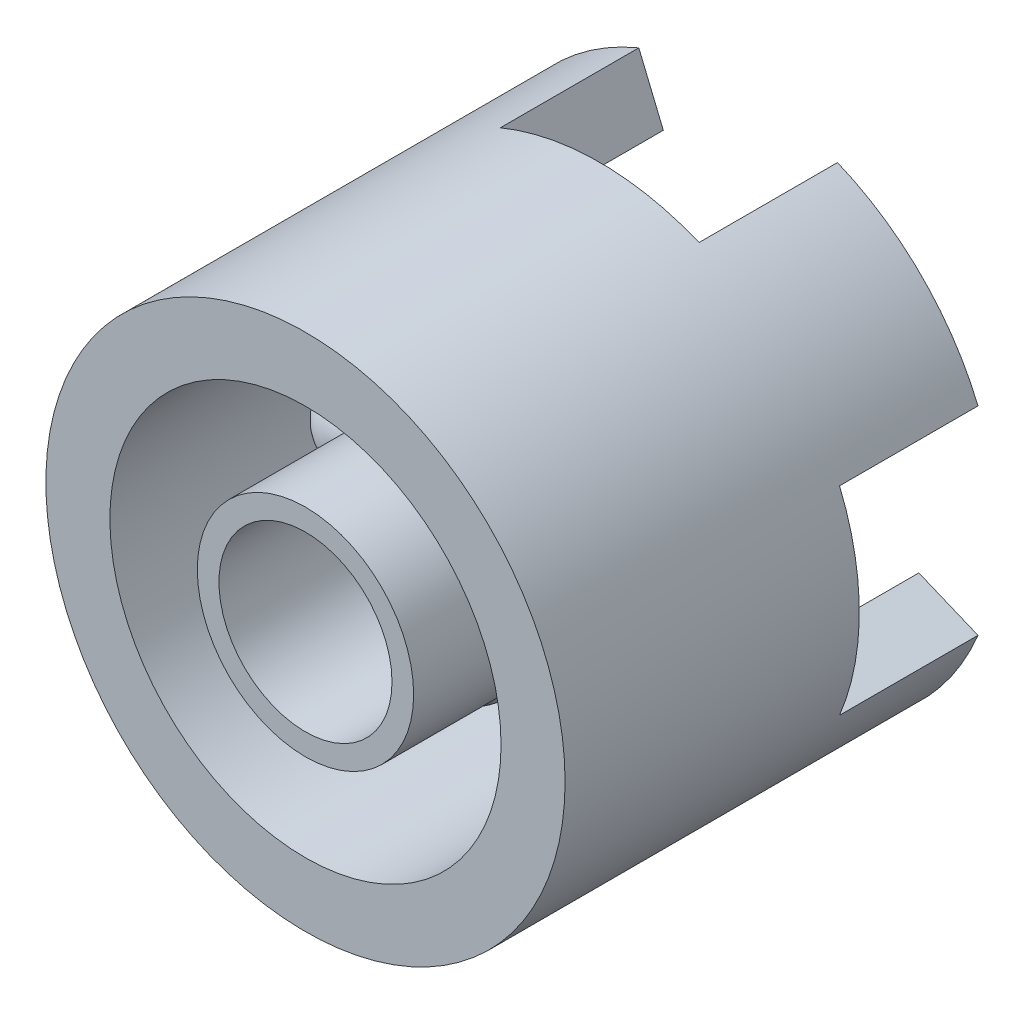
from build123d import *

# Parameters (mm, degrees)
SKETCH1_R             = 19.05
SKETCH1_R_2           = 14.351
BOSS_EXTRUDE1_DEPTH   = 31.75
SKETCH1_R_3           = 7.9375
SKETCH1_R_4           = 6.35
BOSS_EXTRUDE1_2_DEPTH = 31.75
CIRPATTERN1_COUNT     = 10
CUT_EXTRUDE1_DEPTH    = 10.16


with BuildPart() as part:
    # Sketch1 → Boss-Extrude1 (new body)
    with BuildSketch(Plane.XY):
        Circle(SKETCH1_R)
        Circle(SKETCH1_R_2, mode=Mode.SUBTRACT)
    extrude(amount=BOSS_EXTRUDE1_DEPTH)

    # Sketch3 → Cut-Extrude1 (cut)
    with BuildSketch(Plane(origin=(0, 0, 0), x_dir=(-1, 0, 0), z_dir=(0, 0, -1))):
        with BuildLine():
            Line((-7.290119387, 17.599905094), (-5.491889938, 13.258595171))
            ThreePointArc((-5.491889938, 13.258595171), (0, 14.351), (5.491889938, 13.258595171))
            Line((5.491889938, 13.258595171), (7.290119387, 17.599905094))
            ThreePointArc((7.290119387, 17.599905094), (0, 19.05), (-7.290119387, 17.599905094))
        make_face()
        with BuildLine():
            Line((17.599905094, 7.290119387), (13.258595171, 5.491889938))
            ThreePointArc((13.258595171, 5.491889938), (14.351, 0), (13.258595171, -5.491889938))
            Line((13.258595171, -5.491889938), (17.599905094, -7.290119387))
            ThreePointArc((17.599905094, -7.290119387), (19.05, 0), (17.599905094, 7.290119387))
        make_face()
        with BuildLine():
            Line((7.290119387, -17.599905094), (5.491889938, -13.258595171))
            ThreePointArc((5.491889938, -13.258595171), (0, -14.351), (-5.491889938, -13.258595171))
            Line((-5.491889938, -13.258595171), (-7.290119387, -17.599905094))
            ThreePointArc((-7.290119387, -17.599905094), (0, -19.05), (7.290119387, -17.599905094))
        make_face()
        with BuildLine():
            Line((-17.599905094, -7.290119387), (-13.258595171, -5.491889938))
            ThreePointArc((-13.258595171, -5.491889938), (-14.351, 0), (-13.258595171, 5.491889938))
            Line((-13.258595171, 5.491889938), (-17.599905094, 7.290119387))
            ThreePointArc((-17.599905094, 7.290119387), (-19.05, 0), (-17.599905094, -7.290119387))
        make_face()
    extrude(amount=-CUT_EXTRUDE1_DEPTH, mode=Mode.SUBTRACT)


with BuildPart() as body_2:
    # Sketch1 → Boss-Extrude1 2 (new body)
    with BuildSketch(Plane.XY):
        Circle(SKETCH1_R_3)
        Circle(SKETCH1_R_4, mode=Mode.SUBTRACT)
    extrude(amount=BOSS_EXTRUDE1_2_DEPTH)

    # Sketch2 → Revolve1 (revolve)
    with BuildSketch(Plane(origin=(0, 0, 0), x_dir=(1, 0, 0), z_dir=(0, 1, 0))):
        with BuildLine():
            ThreePointArc((11.049, -12.7), (8.80393597, -13.62993597), (7.874, -15.875))
            Line((7.874, -15.875), (11.049, -15.875))
            Line((11.049, -15.875), (11.049, -12.7))
        make_face()
        with BuildLine():
            Line((11.049, -12.7), (11.049, -15.875))
            Line((11.049, -15.875), (14.224, -15.875))
            ThreePointArc((14.224, -15.875), (13.29406403, -13.62993597), (11.049, -12.7))
        make_face()
    revolve1 = revolve(axis=Axis((7.874, 0, 15.875), (1, 0, 0)))

    # CirPattern1: Revolve1 ×10 about axis
    cirpattern1_axis = Axis((0, 0, 0), (0, 0, 1))
    for i in range(1, CIRPATTERN1_COUNT):
        add(revolve1.rotate(cirpattern1_axis, i * 360 / CIRPATTERN1_COUNT))


solid = Compound([part.part, body_2.part])
